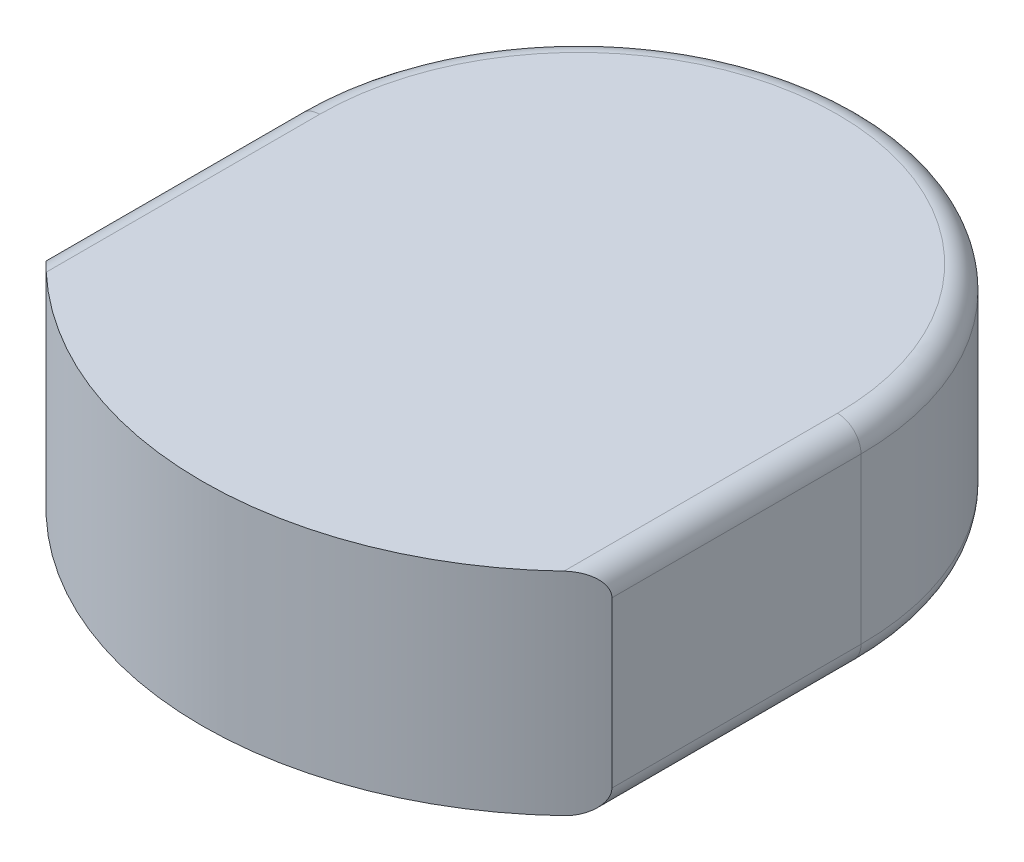
from build123d import *

# Parameters (mm, degrees)
BOSS_EXTRUDE1_DEPTH = 9
FILLET1_R           = 1


with BuildPart() as part:
    # Sketch1 → Boss-Extrude1 (new body)
    with BuildSketch(Plane(origin=(0, 0, 0), x_dir=(1, 0, 0), z_dir=(0, 1, 0))):
        with BuildLine():
            Line((-12, 20.652247549), (-12, 10.069242304))
            ThreePointArc((-12, 10.069242304), (0, 4.652247549), (12, 10.069242304))
            Line((12, 10.069242304), (12, 20.652247549))
            ThreePointArc((12, 20.652247549), (0, 32.652247549), (-12, 20.652247549))
        make_face()
    extrude(amount=BOSS_EXTRUDE1_DEPTH)

    # Fillet1
    fillet1_edges = [part.edges().sort_by_distance(p)[0] for p in [
        (12, 9, -15.360744926),
        (0, 9, -32.652247549),
        (12, 0, -15.360744926),
        (-12, 0, -15.360744926),
        (0, 0, -32.652247549),
        (-12, 9, -15.360744926),
    ]]
    fillet(fillet1_edges, radius=FILLET1_R)


solid = part.part
